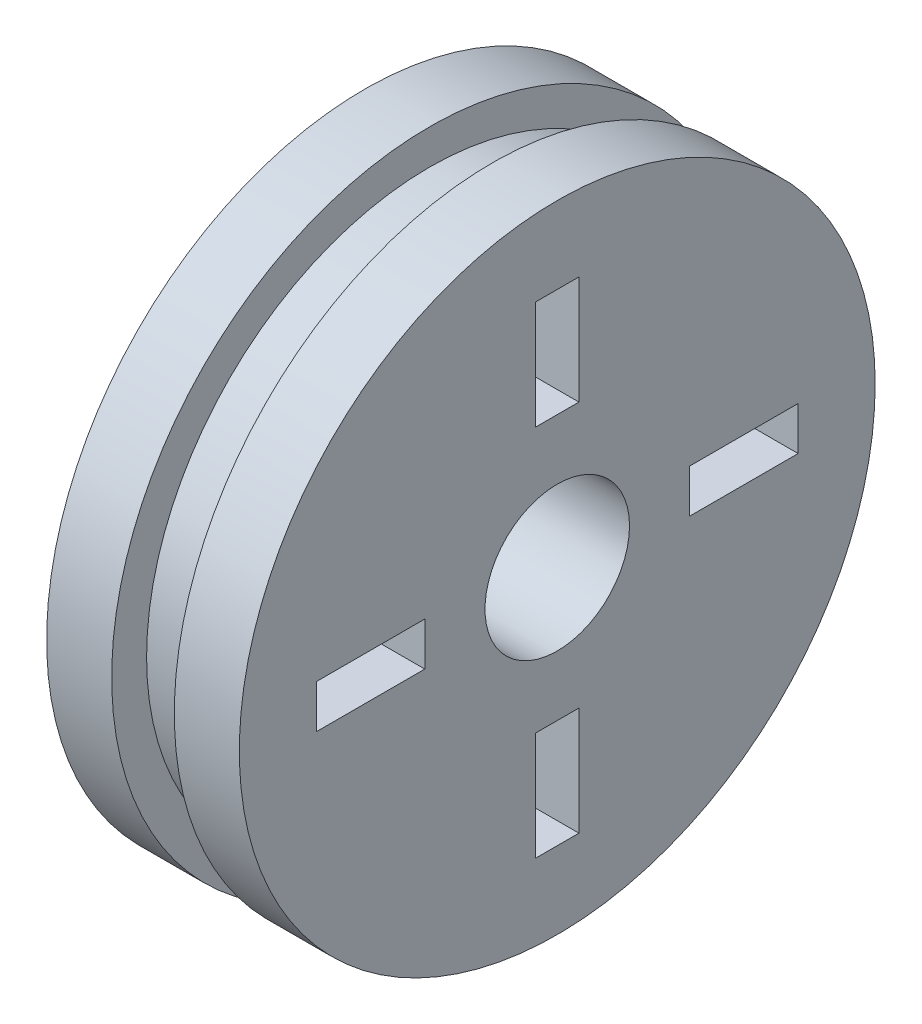
from build123d import *

# Parameters (mm, degrees)
BOSS_EXTRUDE1_START  = 77.2
SKETCH1_R            = 13.2
BOSS_EXTRUDE1_DEPTH  = 8
BOSS_EXTRUDE2_START  = 79.9
SKETCH2_R            = 20
BOSS_EXTRUDE2_DEPTH  = 2.6
BOSS_EXTRUDE3_START  = 79.9
SKETCH3_R            = 11.75
BOSS_EXTRUDE3_DEPTH  = 2.6
BOSS_EXTRUDE4_START  = 76.7
SKETCH4_R            = 4.6
BOSS_EXTRUDE4_DEPTH  = 2.3
BOSS_EXTRUDE5_START  = 62.7
SKETCH5_W            = 2.3
SKETCH5_H            = 11.5
BOSS_EXTRUDE5_DEPTH  = 6.6
BOSS_EXTRUDE6_START  = 65.1
SKETCH6_W            = 10
SKETCH6_H            = 4.5
BOSS_EXTRUDE6_DEPTH  = 1.8
BOSS_EXTRUDE7_START  = 62.7
SKETCH7_W            = 2.3
SKETCH7_H            = 11.5
BOSS_EXTRUDE7_DEPTH  = 6.6
BOSS_EXTRUDE8_START  = 65.1
SKETCH8_W            = 10
SKETCH8_H            = 4.5
BOSS_EXTRUDE8_DEPTH  = 1.8
BOSS_EXTRUDE9_START  = 66
SKETCH9_W            = 2.3
SKETCH9_H            = 6.6
BOSS_EXTRUDE9_DEPTH  = 11.5
BOSS_EXTRUDE10_START = 71.5
SKETCH10_W           = 10
SKETCH10_H           = 1.8
BOSS_EXTRUDE10_DEPTH = 4.5
BOSS_EXTRUDE11_START = 54.5
SKETCH11_W           = 2.3
SKETCH11_H           = 6.6
BOSS_EXTRUDE11_DEPTH = 11.5
BOSS_EXTRUDE12_START = 56
SKETCH12_W           = 10
SKETCH12_H           = 1.8
BOSS_EXTRUDE12_DEPTH = 4.5
BOSS_EXTRUDE13_START = 76.2
SKETCH13_R           = 3
BOSS_EXTRUDE13_DEPTH = 10


with BuildPart() as part:
    # Sketch1 → Boss-Extrude1 (new body)
    with BuildSketch(Plane(origin=(0, 0, 0), x_dir=(0, 0, -1), z_dir=(1, 0, 0)).offset(BOSS_EXTRUDE1_START)):
        with Locations((-66, -65)):
            Circle(SKETCH1_R)
    extrude(amount=BOSS_EXTRUDE1_DEPTH)


with BuildPart() as body_2:
    # Sketch2 → Boss-Extrude2 (new body)
    with BuildSketch(Plane(origin=(0, 0, 0), x_dir=(0, 0, -1), z_dir=(1, 0, 0)).offset(BOSS_EXTRUDE2_START)):
        with Locations((-66, -65)):
            Circle(SKETCH2_R)
    extrude(amount=BOSS_EXTRUDE2_DEPTH)


with BuildPart() as part_1:
    add(part.part)

    # Combine1: cut body 2
    add(body_2.part, mode=Mode.SUBTRACT)

    # Sketch3 → Boss-Extrude3 (add)
    with BuildSketch(Plane(origin=(0, 0, 0), x_dir=(0, 0, -1), z_dir=(1, 0, 0)).offset(BOSS_EXTRUDE3_START)):
        with Locations((-66, -65)):
            Circle(SKETCH3_R)
    extrude(amount=BOSS_EXTRUDE3_DEPTH)


with BuildPart() as body_2_2:
    # Sketch4 → Boss-Extrude4 (new body)
    with BuildSketch(Plane(origin=(0, 0, 0), x_dir=(0, 0, -1), z_dir=(1, 0, 0)).offset(BOSS_EXTRUDE4_START)):
        with Locations((-66, -65)):
            Circle(SKETCH4_R)
    extrude(amount=BOSS_EXTRUDE4_DEPTH)


with BuildPart() as part_2:
    add(part_1.part)

    # Combine2: cut body 2 2
    add(body_2_2.part, mode=Mode.SUBTRACT)


with BuildPart() as body_2_3:
    # Sketch5 → Boss-Extrude5 (new body)
    with BuildSketch(Plane.XY.offset(BOSS_EXTRUDE5_START)):
        with Locations((77.85, -59.25)):
            Rectangle(SKETCH5_W, SKETCH5_H)
    extrude(amount=BOSS_EXTRUDE5_DEPTH)


with BuildPart() as part_3:
    add(part_2.part)

    # Combine3: cut body 2 3
    add(body_2_3.part, mode=Mode.SUBTRACT)


with BuildPart() as body_2_4:
    # Sketch6 → Boss-Extrude6 (new body)
    with BuildSketch(Plane.XY.offset(BOSS_EXTRUDE6_START)):
        with Locations((81.2, -57.25)):
            Rectangle(SKETCH6_W, SKETCH6_H)
    extrude(amount=BOSS_EXTRUDE6_DEPTH)


with BuildPart() as part_4:
    add(part_3.part)

    # Combine4: cut body 2 4
    add(body_2_4.part, mode=Mode.SUBTRACT)


with BuildPart() as body_2_5:
    # Sketch7 → Boss-Extrude7 (new body)
    with BuildSketch(Plane.XY.offset(BOSS_EXTRUDE7_START)):
        with Locations((77.85, -70.75)):
            Rectangle(SKETCH7_W, SKETCH7_H)
    extrude(amount=BOSS_EXTRUDE7_DEPTH)


with BuildPart() as part_5:
    add(part_4.part)

    # Combine5: cut body 2 5
    add(body_2_5.part, mode=Mode.SUBTRACT)


with BuildPart() as body_2_6:
    # Sketch8 → Boss-Extrude8 (new body)
    with BuildSketch(Plane.XY.offset(BOSS_EXTRUDE8_START)):
        with Locations((81.2, -72.75)):
            Rectangle(SKETCH8_W, SKETCH8_H)
    extrude(amount=BOSS_EXTRUDE8_DEPTH)


with BuildPart() as part_6:
    add(part_5.part)

    # Combine6: cut body 2 6
    add(body_2_6.part, mode=Mode.SUBTRACT)


with BuildPart() as body_2_7:
    # Sketch9 → Boss-Extrude9 (new body)
    with BuildSketch(Plane.XY.offset(BOSS_EXTRUDE9_START)):
        with Locations((77.85, -65)):
            Rectangle(SKETCH9_W, SKETCH9_H)
    extrude(amount=BOSS_EXTRUDE9_DEPTH)


with BuildPart() as part_7:
    add(part_6.part)

    # Combine7: cut body 2 7
    add(body_2_7.part, mode=Mode.SUBTRACT)


with BuildPart() as body_2_8:
    # Sketch10 → Boss-Extrude10 (new body)
    with BuildSketch(Plane.XY.offset(BOSS_EXTRUDE10_START)):
        with Locations((81.2, -65)):
            Rectangle(SKETCH10_W, SKETCH10_H)
    extrude(amount=BOSS_EXTRUDE10_DEPTH)


with BuildPart() as part_8:
    add(part_7.part)

    # Combine8: cut body 2 8
    add(body_2_8.part, mode=Mode.SUBTRACT)


with BuildPart() as body_2_9:
    # Sketch11 → Boss-Extrude11 (new body)
    with BuildSketch(Plane.XY.offset(BOSS_EXTRUDE11_START)):
        with Locations((77.85, -65)):
            Rectangle(SKETCH11_W, SKETCH11_H)
    extrude(amount=BOSS_EXTRUDE11_DEPTH)


with BuildPart() as part_9:
    add(part_8.part)

    # Combine9: cut body 2 9
    add(body_2_9.part, mode=Mode.SUBTRACT)


with BuildPart() as body_2_10:
    # Sketch12 → Boss-Extrude12 (new body)
    with BuildSketch(Plane.XY.offset(BOSS_EXTRUDE12_START)):
        with Locations((81.2, -65)):
            Rectangle(SKETCH12_W, SKETCH12_H)
    extrude(amount=BOSS_EXTRUDE12_DEPTH)


with BuildPart() as part_10:
    add(part_9.part)

    # Combine10: cut body 2 10
    add(body_2_10.part, mode=Mode.SUBTRACT)


with BuildPart() as body_2_11:
    # Sketch13 → Boss-Extrude13 (new body)
    with BuildSketch(Plane(origin=(0, 0, 0), x_dir=(0, 0, -1), z_dir=(1, 0, 0)).offset(BOSS_EXTRUDE13_START)):
        with Locations((-66, -65)):
            Circle(SKETCH13_R)
    extrude(amount=BOSS_EXTRUDE13_DEPTH)


with BuildPart() as part_11:
    add(part_10.part)

    # Combine11: cut body 2 11
    add(body_2_11.part, mode=Mode.SUBTRACT)


solid = part_11.part
